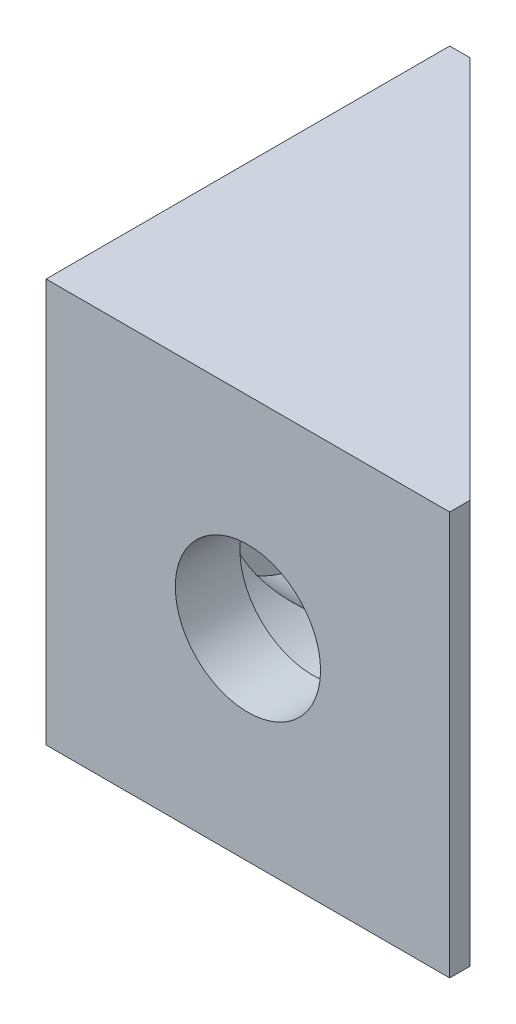
from build123d import *

# Parameters (mm, degrees)
BOSS_EXTRUDE1_DEPTH = 10
CUT_EXTRUDE1_REACH  = 32
SKETCH3_R           = 3.6
CUT_EXTRUDE3_REACH  = 39.344
CUT_EXTRUDE3_START  = -3.2
SKETCH3_4_R         = 5.5
SKETCH3_4_R_2       = 3.6
CUT_EXTRUDE2_REACH  = 32
SKETCH4_R           = 3.6
CUT_EXTRUDE4_REACH  = 35.2
CUT_EXTRUDE4_START  = -3.2
SKETCH4_3_R         = 5.5
SKETCH4_3_R_2       = 3.6


with BuildPart() as part:
    # Sketch2 → Boss-Extrude1 (new, symmetric)
    with BuildSketch(Plane(origin=(0, 0, 0), x_dir=(1, 0, 0), z_dir=(0, 1, 0))):
        Polygon((0, 0), (0, 20), (1, 20), (20, 1), (20, 0), align=None)
    extrude(amount=BOSS_EXTRUDE1_DEPTH, both=True)

    # Cut-Extrude1: up to this plane
    cut_extrude1_end = Plane(origin=(1, 10, -20), z_dir=(-0.7071067811865476, 0, 0.7071067811865476))
    # Sketch3 → Cut-Extrude1 (cut, up to the surface)
    with BuildSketch(Plane.XY, mode=Mode.PRIVATE) as cut_extrude1_sk1:
        with Locations((10, 0)):
            Circle(SKETCH3_R)
    cut_extrude1_tool1 = split(extrude(cut_extrude1_sk1.sketch, amount=-CUT_EXTRUDE1_REACH, mode=Mode.PRIVATE), bisect_by=cut_extrude1_end, keep=Keep.BOTH, mode=Mode.PRIVATE)
    add(cut_extrude1_tool1.solids().sort_by_distance((10, 0, 0))[0], mode=Mode.SUBTRACT)

    # Cut-Extrude3: up to this plane
    cut_extrude3_end = Plane(origin=(1, 10, -20), z_dir=(-0.7071067811865476, 0, 0.7071067811865476))
    # Sketch3<4> → Cut-Extrude3 (cut, up to the surface)
    with BuildSketch(Plane.XY.offset(CUT_EXTRUDE3_START), mode=Mode.PRIVATE) as cut_extrude3_sk1:
        with Locations((10, 0)):
            Circle(SKETCH3_4_R)
        with Locations((10, 0)):
            Circle(SKETCH3_4_R_2, mode=Mode.SUBTRACT)
    cut_extrude3_tool1 = split(extrude(cut_extrude3_sk1.sketch, amount=-CUT_EXTRUDE3_REACH, mode=Mode.PRIVATE), bisect_by=cut_extrude3_end, keep=Keep.BOTH, mode=Mode.PRIVATE)
    add(cut_extrude3_tool1.solids().sort_by_distance((4.655563, 0, -3.2))[0], mode=Mode.SUBTRACT)

    # Cut-Extrude2: up to this plane
    cut_extrude2_end = Plane(origin=(1, 10, -20), z_dir=(-0.7071067811865476, 0, 0.7071067811865476))
    # Sketch4 → Cut-Extrude2 (cut, up to the surface)
    with BuildSketch(Plane.ZY, mode=Mode.PRIVATE) as cut_extrude2_sk1:
        with Locations((-10, 0)):
            Circle(SKETCH4_R)
    cut_extrude2_tool1 = split(extrude(cut_extrude2_sk1.sketch, amount=-CUT_EXTRUDE2_REACH, mode=Mode.PRIVATE), bisect_by=cut_extrude2_end, keep=Keep.BOTH, mode=Mode.PRIVATE)
    add(cut_extrude2_tool1.solids().sort_by_distance((0, 0, -10))[0], mode=Mode.SUBTRACT)

    # Cut-Extrude4: up to this plane
    cut_extrude4_end = Plane(origin=(1, 10, -20), z_dir=(-0.7071067811865476, 0, 0.7071067811865476))
    # Sketch4<3> → Cut-Extrude4 (cut, up to the surface)
    with BuildSketch(Plane.ZY.offset(CUT_EXTRUDE4_START), mode=Mode.PRIVATE) as cut_extrude4_sk1:
        with Locations((-10, 0)):
            Circle(SKETCH4_3_R)
        with Locations((-10, 0)):
            Circle(SKETCH4_3_R_2, mode=Mode.SUBTRACT)
    cut_extrude4_tool1 = split(extrude(cut_extrude4_sk1.sketch, amount=-CUT_EXTRUDE4_REACH, mode=Mode.PRIVATE), bisect_by=cut_extrude4_end, keep=Keep.BOTH, mode=Mode.PRIVATE)
    add(cut_extrude4_tool1.solids().sort_by_distance((3.2, 0, -15.344437))[0], mode=Mode.SUBTRACT)


solid = part.part
